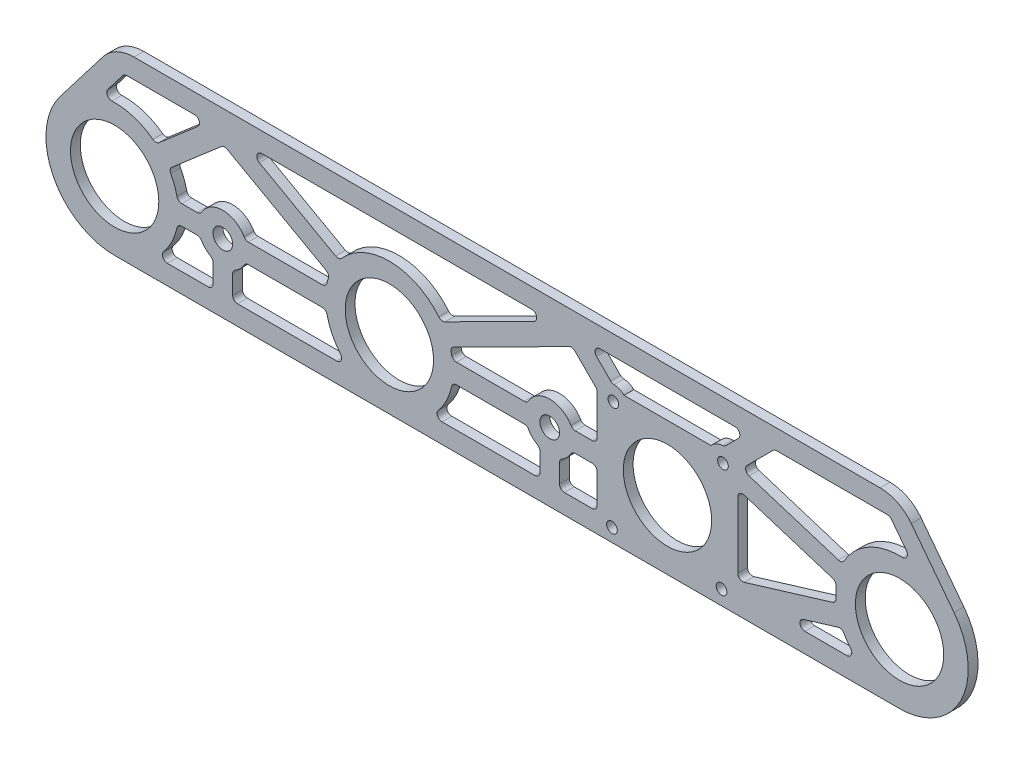
from build123d import *

# Parameters (mm, degrees)
SKETCH1_R                   = 14.29385
BOSS_EXTRUDE2_DEPTH         = 3.175
SKETCH5_R                   = 14.29385
CUT_EXTRUDE6_DEPTH          = 154.659831792
F_8_32_TAPPED_HOLE1_D       = 3.4544
F_1_4_0_25_DIAMETER_HOLE1_D = 6.35
CUT_EXTRUDE7_DEPTH          = 154.659831792
FILLET5_R                   = 1.5875
FILLET6_R                   = 12.7


with BuildPart() as part:
    # Sketch1 → Boss-Extrude2 (new body)
    with BuildSketch(Plane.XY):
        with BuildLine():
            Line((-127, 36.5125), (-144.633399639, 13.52826087))
            ThreePointArc((-144.633399639, 13.52826087), (-146.93258918, -9.830692427), (-127, -22.225))
            Line((-127, -22.225), (127, -22.225))
            ThreePointArc((127, -22.225), (146.93258918, -9.830692427), (144.633399639, 13.52826087))
            Line((144.633399639, 13.52826087), (127, 36.5125))
            Line((127, 36.5125), (-127, 36.5125))
        make_face()
        with Locations((-127, 0)):
            Circle(SKETCH1_R, mode=Mode.SUBTRACT)
        with Locations((-38.1, 0)):
            Circle(SKETCH1_R, mode=Mode.SUBTRACT)
        with Locations((127, 0)):
            Circle(SKETCH1_R, mode=Mode.SUBTRACT)
    extrude(amount=BOSS_EXTRUDE2_DEPTH)

    # Sketch5 → Cut-Extrude6 (cut, through all)
    with BuildSketch(Plane.XY.offset(3.175)):
        with Locations((51.893067042, 0)):
            Circle(SKETCH5_R)
    extrude(amount=-CUT_EXTRUDE6_DEPTH, mode=Mode.SUBTRACT)

    # #8-32 Tapped Hole1 (through all)
    with Locations(Plane.XY.offset(3.175)):
        with Locations((69.853579284, 17.960512242), (34.393067042, 17.5), (33.9325548, -17.960512242), (69.393067042, -17.5)):
            Hole(F_8_32_TAPPED_HOLE1_D / 2)

    # 1/4 (0.25) Diameter Hole1 (through all)
    with Locations(Plane.XY.offset(3.175)):
        with Locations((-91.990319194, 0), (13.793067042, 0)):
            Hole(F_1_4_0_25_DIAMETER_HOLE1_D / 2)

    # Sketch11 → Cut-Extrude7 (cut, through all)
    with BuildSketch(Plane.XY.offset(3.175)):
        with BuildLine():
            ThreePointArc((-106.601766797, -3.175), (-109.042344213, -10.182884731), (-113.80329898, -15.875))
            Line((-113.80329898, -15.875), (-95.165319194, -15.875))
            Line((-95.165319194, -15.875), (-95.165319194, -7.274838916))
            ThreePointArc((-95.165319194, -7.274838916), (-97.60297927, -5.612660076), (-99.26515811, -3.175))
            Line((-99.26515811, -3.175), (-106.601766797, -3.175))
        make_face()
        with BuildLine():
            Line((-123.868199292, 30.1625), (-131.562510923, 20.133356325))
            ThreePointArc((-131.562510923, 20.133356325), (-122.069102838, 20.04631627), (-113.618553195, 15.719587279))
            Line((-113.618553195, 15.719587279), (-96.85463229, 30.1625))
            Line((-96.85463229, 30.1625), (-123.868199292, 30.1625))
        make_face()
        with BuildLine():
            ThreePointArc((-84.715480278, -3.175), (-86.377659118, -5.612660076), (-88.815319194, -7.274838916))
            Line((-88.815319194, -7.274838916), (-88.815319194, -15.875))
            Line((-88.815319194, -15.875), (-51.29670102, -15.875))
            ThreePointArc((-51.29670102, -15.875), (-56.057655787, -10.182884731), (-58.498233203, -3.175))
            Line((-58.498233203, -3.175), (-84.715480278, -3.175))
        make_face()
        with BuildLine():
            Line((-106.601766797, 3.175), (-99.26515811, 3.175))
            ThreePointArc((-99.26515811, 3.175), (-91.990319194, 7.9375), (-84.715480278, 3.175))
            Line((-84.715480278, 3.175), (-58.498233203, 3.175))
            ThreePointArc((-58.498233203, 3.175), (-58.075615782, 5.209924849), (-57.450531131, 7.192043364))
            Line((-57.450531131, 7.192043364), (-91.601678133, 26.306496328))
            Line((-91.601678133, 26.306496328), (-109.473826159, 10.908793394))
            ThreePointArc((-109.473826159, 10.908793394), (-107.647531101, 7.186827557), (-106.601766797, 3.175))
        make_face()
        with BuildLine():
            ThreePointArc((-17.701766797, -3.175), (-20.142344213, -10.182884731), (-24.90329898, -15.875))
            Line((-24.90329898, -15.875), (10.618067042, -15.875))
            Line((10.618067042, -15.875), (10.618067042, -7.274838916))
            ThreePointArc((10.618067042, -7.274838916), (8.180406967, -5.612660076), (6.518228127, -3.175))
            Line((6.518228127, -3.175), (-17.701766797, -3.175))
        make_face()
        with BuildLine():
            Line((-85.489568835, 30.1625), (-54.349158384, 12.733161219))
            ThreePointArc((-54.349158384, 12.733161219), (-37.652956619, 20.639009061), (-21.314736509, 12.017631728))
            Line((-21.314736509, 12.017631728), (14.677563785, 30.1625))
            Line((14.677563785, 30.1625), (-85.489568835, 30.1625))
        make_face()
        with BuildLine():
            Line((21.109289215, 26.293649767), (-18.456202454, 6.347421586))
            ThreePointArc((-18.456202454, 6.347421586), (-18.01624733, 4.77613039), (-17.701766797, 3.175))
            Line((-17.701766797, 3.175), (6.518228127, 3.175))
            ThreePointArc((6.518228127, 3.175), (13.793067042, 7.9375), (21.067905958, 3.175))
            Line((21.067905958, 3.175), (29.143067042, 3.175))
            Line((29.143067042, 3.175), (29.143067042, 18.259871939))
            Line((29.143067042, 18.259871939), (21.109289215, 26.293649767))
        make_face()
        with BuildLine():
            ThreePointArc((21.067905958, -3.175), (19.405727118, -5.612660076), (16.968067042, -7.274838916))
            Line((16.968067042, -7.274838916), (16.968067042, -15.875))
            Line((16.968067042, -15.875), (29.143067042, -15.875))
            Line((29.143067042, -15.875), (29.143067042, -3.175))
            Line((29.143067042, -3.175), (21.067905958, -3.175))
        make_face()
        with BuildLine():
            ThreePointArc((33.997019579, 22.386175524), (36.061980752, 22.109370008), (37.82549546, 21))
            Line((37.82549546, 21), (66.00740209, 21))
            ThreePointArc((66.00740209, 21), (67.896946279, 22.455303908), (70.249626747, 22.846687766))
            Line((70.249626747, 22.846687766), (77.565438982, 30.1625))
            Line((77.565438982, 30.1625), (26.220695103, 30.1625))
            Line((26.220695103, 30.1625), (33.997019579, 22.386175524))
        make_face()
        with BuildLine():
            ThreePointArc((108.492193511, 9.144924374), (118.122825546, 18.637712213), (131.562510923, 20.133356325))
            Line((131.562510923, 20.133356325), (123.868199292, 30.1625))
            Line((123.868199292, 30.1625), (86.545695103, 30.1625))
            Line((86.545695103, 30.1625), (75.802227968, 19.419032866))
            Line((75.802227968, 19.419032866), (108.492193511, 9.144924374))
        make_face()
        with BuildLine():
            Line((85.665440562, -15.875), (113.80329898, -15.875))
            ThreePointArc((113.80329898, -15.875), (110.73338621, -12.710854363), (108.405341586, -8.967007377))
            Line((108.405341586, -8.967007377), (85.665440562, -15.875))
        make_face()
        with BuildLine():
            ThreePointArc((106.5596071, -2.891172931), (106.356387346, 0.098992064), (106.588274498, 3.087070596))
            Line((106.588274498, 3.087070596), (74.643067042, 13.127109542))
            Line((74.643067042, 13.127109542), (74.643067042, -12.586871389))
            Line((74.643067042, -12.586871389), (106.5596071, -2.891172931))
        make_face()
    extrude(amount=-CUT_EXTRUDE7_DEPTH, mode=Mode.SUBTRACT)

    # Fillet5
    fillet5_edges = [part.edges().sort_by_distance(p)[0] for p in [
        (-24.90329898, -15.875, 1.5875),
        (-17.701766797, -3.175, 1.5875),
        (6.518228127, -3.175, 1.5875),
        (10.618067042, -7.274838916, 1.5875),
        (10.618067042, -15.875, 1.5875),
        (-21.314736509, 12.017631728, 1.5875),
        (-54.349158384, 12.733161219, 1.5875),
        (-85.489568835, 30.1625, 1.5875),
        (14.677563785, 30.1625, 1.5875),
        (-57.450531131, 7.192043364, 1.5875),
        (-58.498233203, 3.175, 1.5875),
        (-84.715480278, 3.175, 1.5875),
        (-99.26515811, 3.175, 1.5875),
        (-106.601766797, 3.175, 1.5875),
        (-109.473826159, 10.908793394, 1.5875),
        (-91.601678133, 26.306496328, 1.5875),
        (-113.618553195, 15.719587279, 1.5875),
        (-131.562510923, 20.133356325, 1.5875),
        (-123.868199292, 30.1625, 1.5875),
        (-96.85463229, 30.1625, 1.5875),
        (108.405341586, -8.967007377, 1.5875),
        (113.80329898, -15.875, 1.5875),
        (85.665440562, -15.875, 1.5875),
        (106.588274498, 3.087070596, 1.5875),
        (106.5596071, -2.891172931, 1.5875),
        (74.643067042, -12.586871389, 1.5875),
        (74.643067042, 13.127109542, 1.5875),
        (21.067905958, 3.175, 1.5875),
        (6.518228127, 3.175, 1.5875),
        (-17.701766797, 3.175, 1.5875),
        (-18.456202454, 6.347421586, 1.5875),
        (21.109289215, 26.293649767, 1.5875),
        (29.143067042, 18.259871939, 1.5875),
        (29.143067042, 3.175, 1.5875),
        (33.997019579, 22.386175524, 1.5875),
        (26.220695103, 30.1625, 1.5875),
        (77.565438982, 30.1625, 1.5875),
        (70.249626747, 22.846687766, 1.5875),
        (-99.26515811, -3.175, 1.5875),
        (-95.165319194, -7.274838916, 1.5875),
        (-95.165319194, -15.875, 1.5875),
        (-113.80329898, -15.875, 1.5875),
        (-106.601766797, -3.175, 1.5875),
        (-88.815319194, -7.274838916, 1.5875),
        (-84.715480278, -3.175, 1.5875),
        (-58.498233203, -3.175, 1.5875),
        (-51.29670102, -15.875, 1.5875),
        (-88.815319194, -15.875, 1.5875),
        (16.968067042, -7.274838916, 1.5875),
        (21.067905958, -3.175, 1.5875),
        (29.143067042, -3.175, 1.5875),
        (29.143067042, -15.875, 1.5875),
        (16.968067042, -15.875, 1.5875),
        (131.562510923, 20.133356325, 1.5875),
        (108.492193511, 9.144924374, 1.5875),
        (75.802227968, 19.419032866, 1.5875),
        (86.545695103, 30.1625, 1.5875),
        (123.868199292, 30.1625, 1.5875),
    ]]
    fillet(fillet5_edges, radius=FILLET5_R)

    # Fillet6
    fillet6_edges = [part.edges().sort_by_distance(p)[0] for p in [
        (-127, 36.5125, 1.5875),
        (127, 36.5125, 1.5875),
    ]]
    fillet(fillet6_edges, radius=FILLET6_R)


solid = part.part
